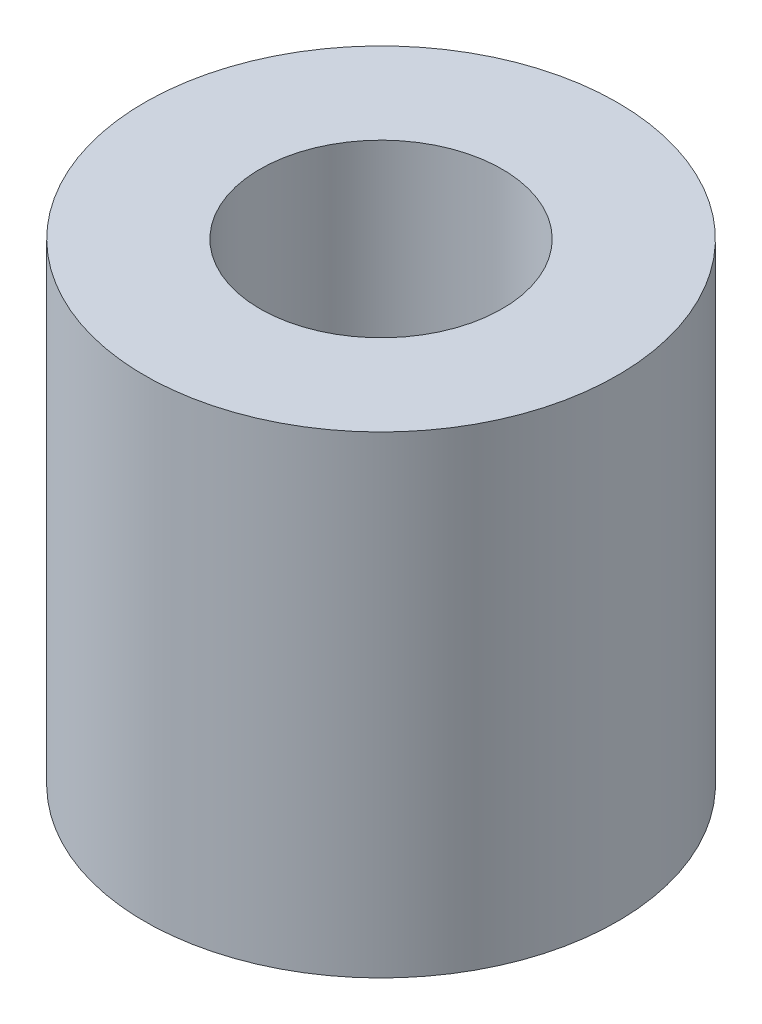
from build123d import *

# Parameters (mm, degrees)
SKETCH1_W             = 2.38125
SKETCH1_H             = 4.7625
F_2_CLEARANCE_HOLE1_D = 2.4384


with BuildPart() as part:
    # Sketch1 → Revolve1 (revolve)
    with BuildSketch(Plane.XY, mode=Mode.PRIVATE) as revolve1_sk:
        with Locations((1.190625, 2.38125)):
            Rectangle(SKETCH1_W, SKETCH1_H)
    revolve(revolve1_sk.sketch.rotate(Axis((0, 0, 0), (0, 1, 0)), 90), axis=Axis((0, 0, 0), (0, 1, 0)))

    # #2 Clearance Hole1 (through all)
    with Locations(Plane(origin=(0, 4.7625, 0), x_dir=(1, 0, 0), z_dir=(0, 1, 0))):
        with Locations((0, 0)):
            Hole(F_2_CLEARANCE_HOLE1_D / 2)


solid = part.part
